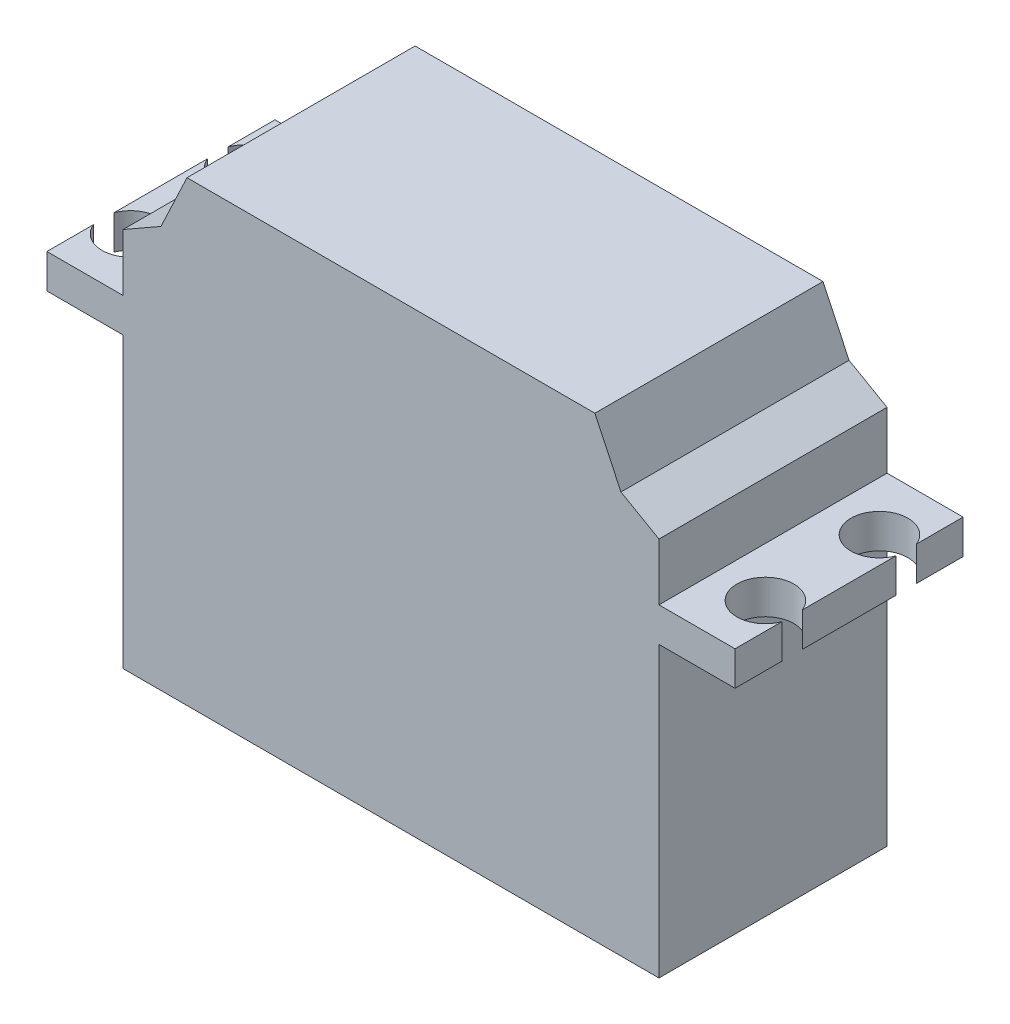
from build123d import *

# Parameters (mm, degrees)
SKETCH1_W           = 35.814
SKETCH1_H           = 15.24
BOSS_EXTRUDE1_DEPTH = 25.4
BOSS_EXTRUDE2_DEPTH = 15.24
BOSS_EXTRUDE3_DEPTH = 15.24
SKETCH4_W           = 5.08
SKETCH4_H           = 2.286
BOSS_EXTRUDE4_DEPTH = 15.24
SKETCH5_R           = 1.905
CUT_EXTRUDE1_DEPTH  = 2.286


with BuildPart() as part:
    # Sketch1 → Boss-Extrude1 (new body)
    with BuildSketch(Plane(origin=(0, 0, 0), x_dir=(1, 0, 0), z_dir=(0, 1, 0))):
        Rectangle(SKETCH1_W, SKETCH1_H)
    extrude(amount=BOSS_EXTRUDE1_DEPTH)

    # Sketch2 → Boss-Extrude2 (add)
    with BuildSketch(Plane.XY.offset(7.62)):
        Polygon((-9.017, 30.48), (9.017, 30.48), (17.907, 25.4), (-17.907, 25.4), align=None)
    extrude(amount=-BOSS_EXTRUDE2_DEPTH)

    # Sketch3 → Boss-Extrude3 (add)
    with BuildSketch(Plane.XY.offset(7.62)):
        Polygon((-15.367, 26.851428571), (-13.626884455, 30.540147269), (13.626884455, 30.540147269), (15.367, 26.851428571), (9.017, 30.48), (-9.017, 30.48), align=None)
    extrude(amount=-BOSS_EXTRUDE3_DEPTH)

    # Sketch4 → Boss-Extrude4 (add)
    with BuildSketch(Plane.XY.offset(7.62)):
        with Locations((-20.447, 20.447)):
            Rectangle(SKETCH4_W, SKETCH4_H)
        with Locations((20.447, 20.447)):
            Rectangle(SKETCH4_W, SKETCH4_H)
    extrude(amount=-BOSS_EXTRUDE4_DEPTH)

    # Sketch5 → Cut-Extrude1 (cut)
    with BuildSketch(Plane(origin=(0, 21.59, 0), x_dir=(1, 0, 0), z_dir=(0, 1, 0))):
        with Locations((-21.209, 3.81)):
            Circle(SKETCH5_R)
        with Locations((-21.209, -3.81)):
            Circle(SKETCH5_R)
        with Locations((21.209, -3.81)):
            Circle(SKETCH5_R)
        with Locations((21.209, 3.81)):
            Circle(SKETCH5_R)
    extrude(amount=-CUT_EXTRUDE1_DEPTH, mode=Mode.SUBTRACT)


solid = part.part
